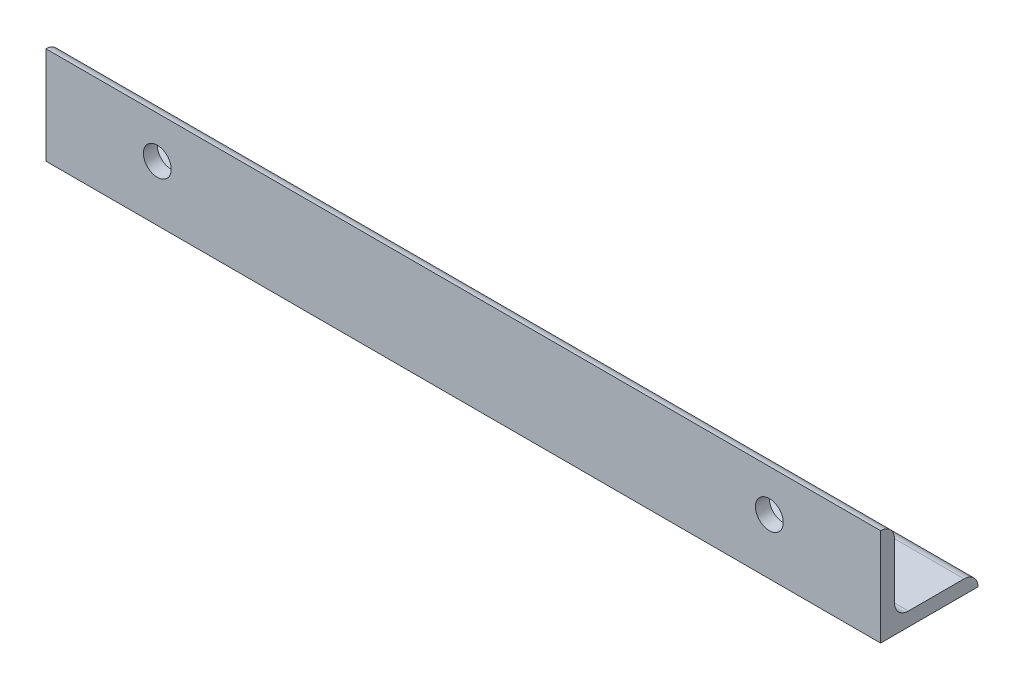
from build123d import *

# Parameters (mm, degrees)
K_TOWNIK_STALOWY_35_X_35_X_5_1_DEPTH = 300
SZKIC2_R                             = 5
WYTNIJ_WYCI_GNI_CIE1_DEPTH           = 304.521004216


with BuildPart() as part:
    # Sketch1 → Kątownik stalowy 35 X 35 X 5(1) (new body)
    with BuildSketch(Plane(origin=(0, 0, 0), x_dir=(0, 0, -1), z_dir=(1, 0, 0))):
        with BuildLine():
            Line((0, 0), (0, 35))
            ThreePointArc((0, 35), (3.535533906, 33.535533906), (5, 30))
            Line((5, 30), (5, 10))
            ThreePointArc((5, 10), (6.464466094, 6.464466094), (10, 5))
            Line((10, 5), (30, 5))
            ThreePointArc((30, 5), (33.535533906, 3.535533906), (35, 0))
            Line((35, 0), (0, 0))
        make_face()
    extrude(amount=K_TOWNIK_STALOWY_35_X_35_X_5_1_DEPTH)

    # Szkic2 → Wytnij-wyciągnięcie1 (cut, through all)
    with BuildSketch(Plane(origin=(0, 0, -5), x_dir=(-1, 0, 0), z_dir=(0, 0, -1))):
        with Locations(Location((-260, 20, 0), (0, 0, 90))):
            Circle(SZKIC2_R)
        with Locations(Location((-40, 20, 0), (0, 0, 90))):
            Circle(SZKIC2_R)
    extrude(amount=-WYTNIJ_WYCI_GNI_CIE1_DEPTH, mode=Mode.SUBTRACT)


solid = part.part
